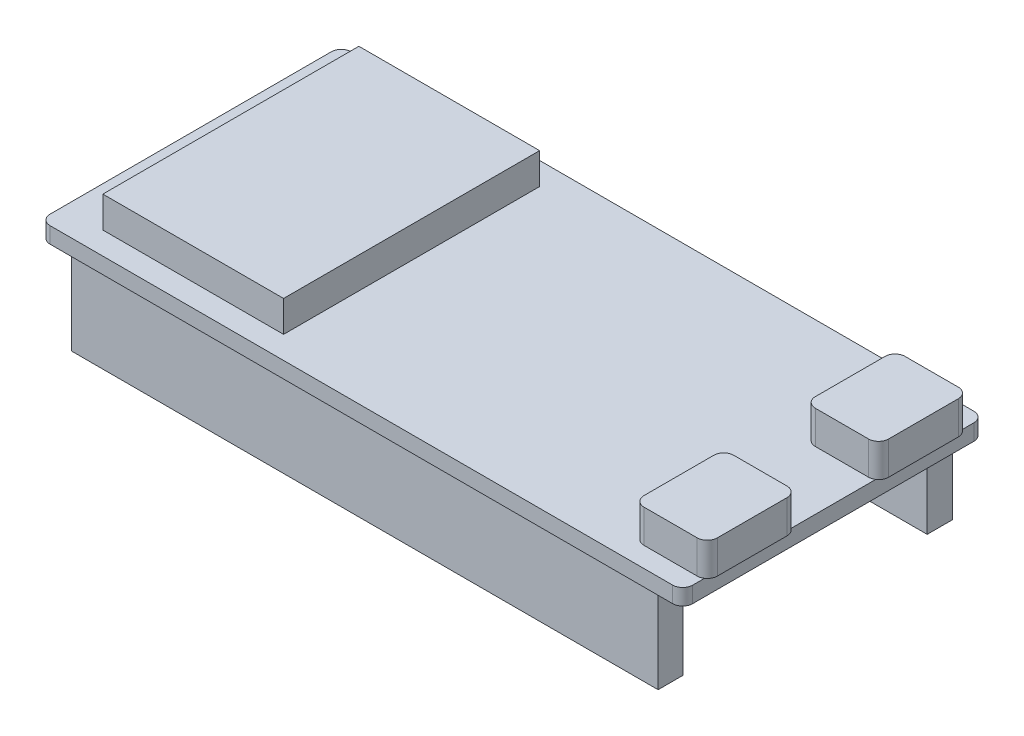
from build123d import *

# Parameters (mm, degrees)
BOARD_START   = 12.5
BOARD_DEPTH   = 1.6
WROOM_START   = 14.1
SKETCH2_W     = 18
SKETCH2_H     = 25.5
WROOM_DEPTH   = 3.1
USB_C_START   = 14.1
USB_C_DEPTH   = 3.3
HEADERS_START = 4
SKETCH4_W     = 58.4
SKETCH4_H     = 2.5
HEADERS_DEPTH = 8.5


with BuildPart() as part:
    # Sketch1 → Board (new body)
    with BuildSketch(Plane(origin=(0, 0, 0), x_dir=(1, 0, 0), z_dir=(0, 1, 0)).offset(BOARD_START)):
        with BuildLine():
            Line((-18, -20), (44, -20))
            ThreePointArc((44, -20), (44.707106781, -20.292893219), (45, -21))
            Line((45, -21), (45, -49))
            ThreePointArc((45, -49), (44.707106781, -49.707106781), (44, -50))
            Line((44, -50), (-18, -50))
            ThreePointArc((-18, -50), (-18.707106781, -49.707106781), (-19, -49))
            Line((-19, -49), (-19, -21))
            ThreePointArc((-19, -21), (-18.707106781, -20.292893219), (-18, -20))
        make_face()
    extrude(amount=BOARD_DEPTH)

    # Sketch2 → WROOM (add)
    with BuildSketch(Plane(origin=(0, 0, 0), x_dir=(1, 0, 0), z_dir=(0, 1, 0)).offset(WROOM_START)):
        with Locations((-6, -35)):
            Rectangle(SKETCH2_W, SKETCH2_H)
    extrude(amount=WROOM_DEPTH)

    # Sketch3 → USB-C (add)
    with BuildSketch(Plane(origin=(0, 0, 0), x_dir=(1, 0, 0), z_dir=(0, 1, 0)).offset(USB_C_START)):
        with BuildLine():
            Line((39.15, -22), (44.45, -22))
            ThreePointArc((44.45, -22), (45.157106781, -22.292893219), (45.45, -23))
            Line((45.45, -23), (45.45, -29.94))
            ThreePointArc((45.45, -29.94), (45.157106781, -30.647106781), (44.45, -30.94))
            Line((44.45, -30.94), (39.15, -30.94))
            ThreePointArc((39.15, -30.94), (38.442893219, -30.647106781), (38.15, -29.94))
            Line((38.15, -29.94), (38.15, -23))
            ThreePointArc((38.15, -23), (38.442893219, -22.292893219), (39.15, -22))
        make_face()
        with BuildLine():
            Line((39.15, -39.06), (44.45, -39.06))
            ThreePointArc((44.45, -39.06), (45.157106781, -39.352893219), (45.45, -40.06))
            Line((45.45, -40.06), (45.45, -47))
            ThreePointArc((45.45, -47), (45.157106781, -47.707106781), (44.45, -48))
            Line((44.45, -48), (39.15, -48))
            ThreePointArc((39.15, -48), (38.442893219, -47.707106781), (38.15, -47))
            Line((38.15, -47), (38.15, -40.06))
            ThreePointArc((38.15, -40.06), (38.442893219, -39.352893219), (39.15, -39.06))
        make_face()
    extrude(amount=USB_C_DEPTH)

    # Sketch4 → Headers (add)
    with BuildSketch(Plane(origin=(0, 0, 0), x_dir=(1, 0, 0), z_dir=(0, 1, 0)).offset(HEADERS_START)):
        with Locations((13, -21.6)):
            Rectangle(SKETCH4_W, SKETCH4_H)
        with Locations((13, -48.4)):
            Rectangle(SKETCH4_W, SKETCH4_H)
    extrude(amount=HEADERS_DEPTH)


solid = part.part
